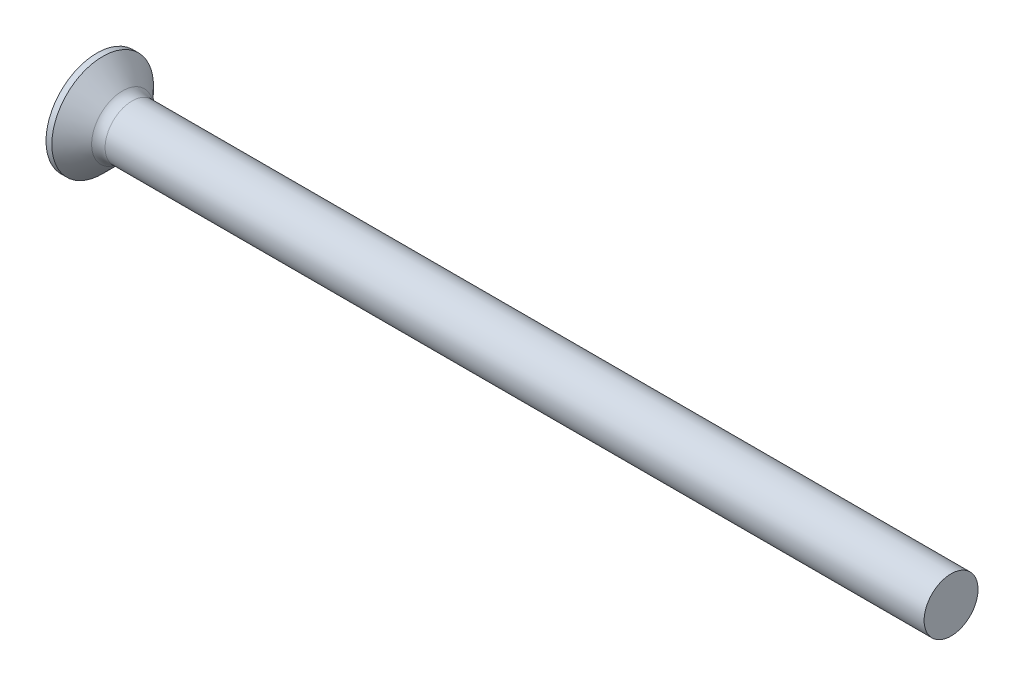
from build123d import *

# Parameters (mm, degrees)
FILLET1_R    = 1.5
RECPAT_COUNT = 2
RECPAT_ANGLE = 90


with BuildPart() as part:
    # BodySke → Base-Revolve (revolve)
    with BuildSketch(Plane.XY, mode=Mode.PRIVATE) as base_revolve_sk:
        Polygon((0, 0), (0, 5.65), (0.65, 5.65), (3.3, 3), (95, 3), (95, 0), align=None)
    revolve(base_revolve_sk.sketch.rotate(Axis((-6.35, 0, 0), (1, 0, 0)), 90), axis=Axis((-6.35, 0, 0), (1, 0, 0)))

    # Fillet1
    fillet1_edges = [part.edges().sort_by_distance(p)[0] for p in [
        (3.3, 0, -3),
    ]]
    fillet(fillet1_edges, radius=FILLET1_R)

    # Sketch3 → Recess section 0
    with BuildSketch(Plane.ZY):
        with BuildLine():
            Line((-0.71, 3.3), (0.71, 3.3))
            Line((0.71, 3.3), (0.71, -3.3))
            Line((0.71, -3.3), (-0.71, -3.3))
            Line((-0.71, -3.3), (-0.71, 3.3))
        make_face()
    # Sketch4 → Recess section 1
    with BuildSketch(Plane.ZY.offset(-3.45)):
        with BuildLine():
            Line((-0.71, 1.57989374), (0.71, 1.57989374))
            Line((0.71, 1.57989374), (0.71, -1.57989374))
            Line((0.71, -1.57989374), (-0.71, -1.57989374))
            Line((-0.71, -1.57989374), (-0.71, 1.57989374))
        make_face()
    recess = loft(mode=Mode.SUBTRACT)

    # RecPat: Recess ×2 about axis
    recpat_axis = Axis((0, 0, 0), (1, 0, 0))
    for i in range(1, RECPAT_COUNT):
        add(recess.rotate(recpat_axis, i * RECPAT_ANGLE / (RECPAT_COUNT - 1)), mode=Mode.SUBTRACT)

    # RecCorSke → RecessCore (revolve, cut)
    with BuildSketch(Plane.XY, mode=Mode.PRIVATE) as recesscore_sk:
        Polygon((0, 0), (0, 1.521747501), (3.45, 1.2805), (3.866059671, 0), align=None)
    revolve(recesscore_sk.sketch.rotate(Axis((-3.175, 0, 0), (1, 0, 0)), 90), axis=Axis((-3.175, 0, 0), (1, 0, 0)), mode=Mode.SUBTRACT)


solid = part.part
